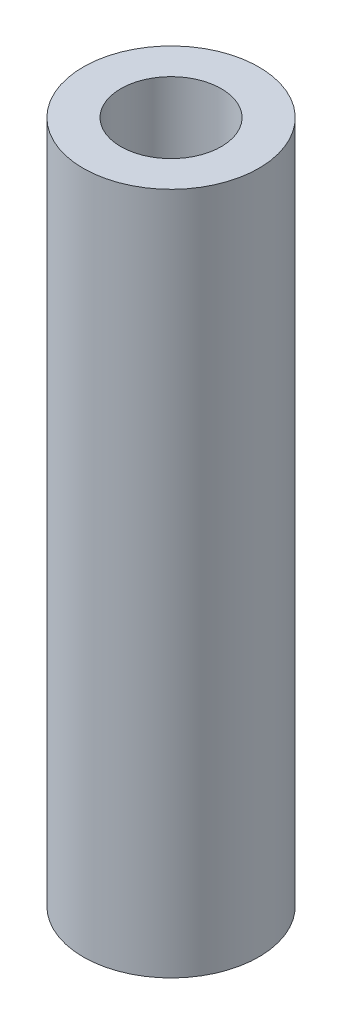
from build123d import *

# Parameters (mm, degrees)
SKETCH_1_R      = 4.5
SKETCH_1_R_2    = 2.575
EXTRUDE_1_DEPTH = 35


with BuildPart() as part:
    # 草图1 → 凸台-拉伸1 (new body)
    with BuildSketch(Plane(origin=(0, 0, 0), x_dir=(1, 0, 0), z_dir=(0, 1, 0))):
        with Locations(Location((0, 0, 0), (0, 0, 270))):
            Circle(SKETCH_1_R)
        with Locations(Location((0, 0, 0), (0, 0, 270))):
            Circle(SKETCH_1_R_2, mode=Mode.SUBTRACT)
    extrude(amount=EXTRUDE_1_DEPTH)


solid = part.part
